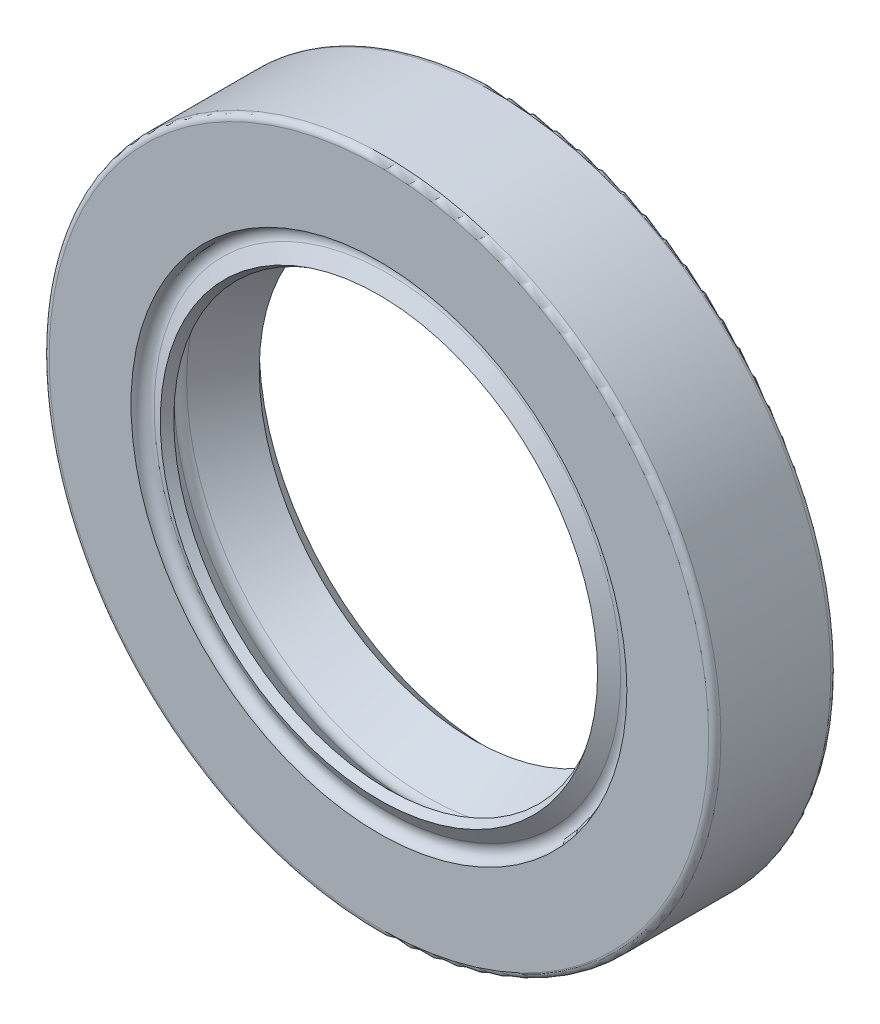
from build123d import *


with BuildPart() as part:
    # Seal Profile → Seal AOP (revolve)
    with BuildSketch(Plane(origin=(0, 0, 0), x_dir=(1, 0, 0), z_dir=(0, 1, 0))):
        with BuildLine():
            Line((11, 3.8), (11, 0.2))
            ThreePointArc((11, 0.2), (10.941421356, 0.058578644), (10.8, 0))
            Line((10.8, 0), (8.120332166, 0))
            ThreePointArc((8.120332166, 0), (7.960165997, 0.277224001), (7.64, 0.276936088))
            Line((7.64, 0.276936088), (7.161658075, 0))
            Line((7.161658075, 0), (7, 0.28))
            Line((7, 0.28), (7.807838284, 1.087838284))
            ThreePointArc((7.807838284, 1.087838284), (7.921573516, 1.31847052), (7.871405733, 1.570680996))
            Line((7.871405733, 1.570680996), (7, 3.08))
            Line((7, 3.08), (7.64, 3.72))
            Line((7.64, 3.72), (8.24, 3.72))
            ThreePointArc((8.24, 3.72), (8.44, 3.52), (8.24, 3.32))
            ThreePointArc((8.24, 3.32), (7.801368265, 2.845327226), (8.309129905, 2.445464551))
            Line((8.309129905, 2.445464551), (8.410870095, 1.282568851))
            ThreePointArc((8.410870095, 1.282568851), (8.474990993, 1.152544533), (8.610109035, 1.1))
            Line((8.610109035, 1.1), (9.589875203, 1.1))
            ThreePointArc((9.589875203, 1.1), (9.724993245, 1.152544533), (9.789114143, 1.282568851))
            Line((9.789114143, 1.282568851), (10.010885857, 3.817431149))
            ThreePointArc((10.010885857, 3.817431149), (10.075006755, 3.947455467), (10.210124797, 4))
            Line((10.210124797, 4), (10.8, 4))
            ThreePointArc((10.8, 4), (10.941421356, 3.941421356), (11, 3.8))
        make_face()
    revolve(axis=Axis((0, 0, 0), (0, 0, -1)))


solid = part.part
